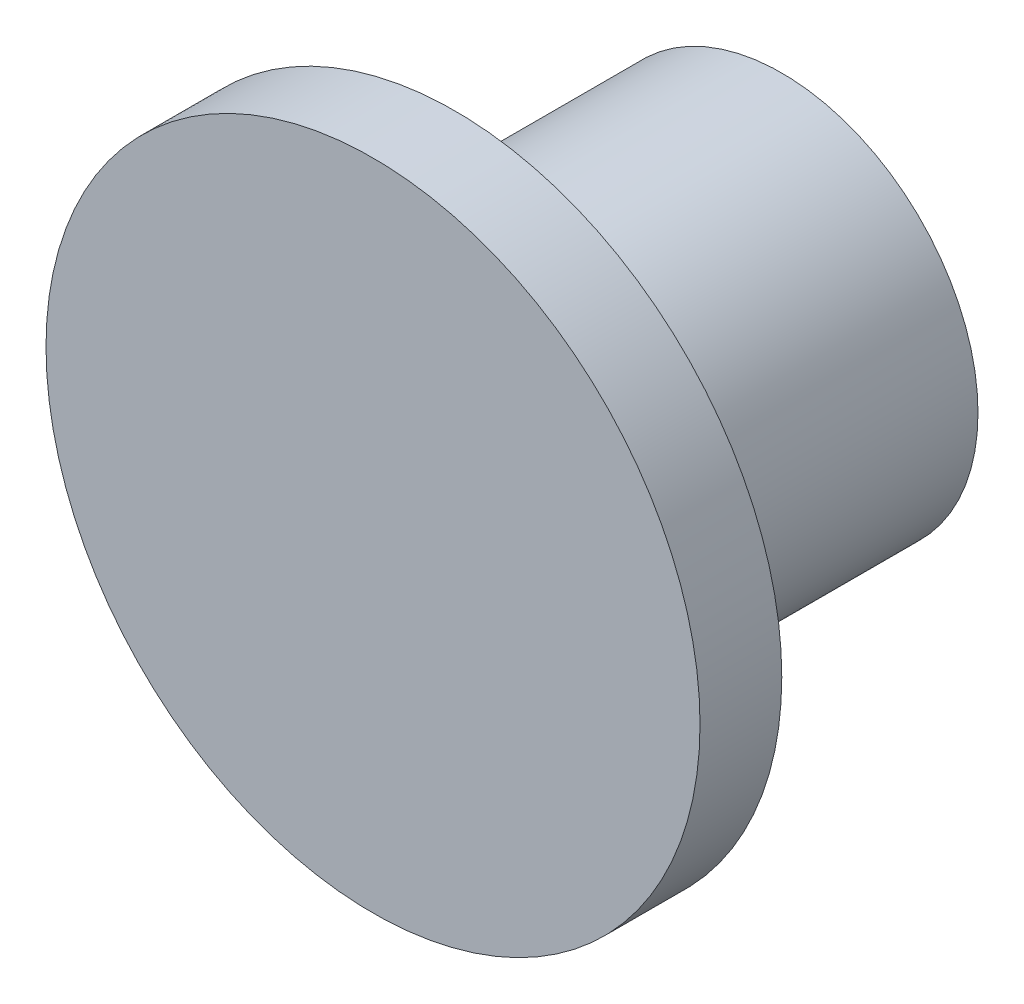
from build123d import *

# Parameters (mm, degrees)
SKETCH1_R           = 20
SKETCH1_R_2         = 12
BOSS_EXTRUDE1_DEPTH = 5
BOSS_EXTRUDE2_START = -25
SKETCH2_R           = 12
BOSS_EXTRUDE2_DEPTH = 25


with BuildPart() as part:
    # Sketch1 → Boss-Extrude1 (new body)
    with BuildSketch(Plane.XY):
        Circle(SKETCH1_R)
        Circle(SKETCH1_R_2, mode=Mode.SUBTRACT)
    extrude(amount=BOSS_EXTRUDE1_DEPTH)

    # Sketch2 → Boss-Extrude2 (add)
    with BuildSketch(Plane.XY.offset(5).offset(BOSS_EXTRUDE2_START)):
        Circle(SKETCH2_R)
    extrude(amount=BOSS_EXTRUDE2_DEPTH)


solid = part.part
